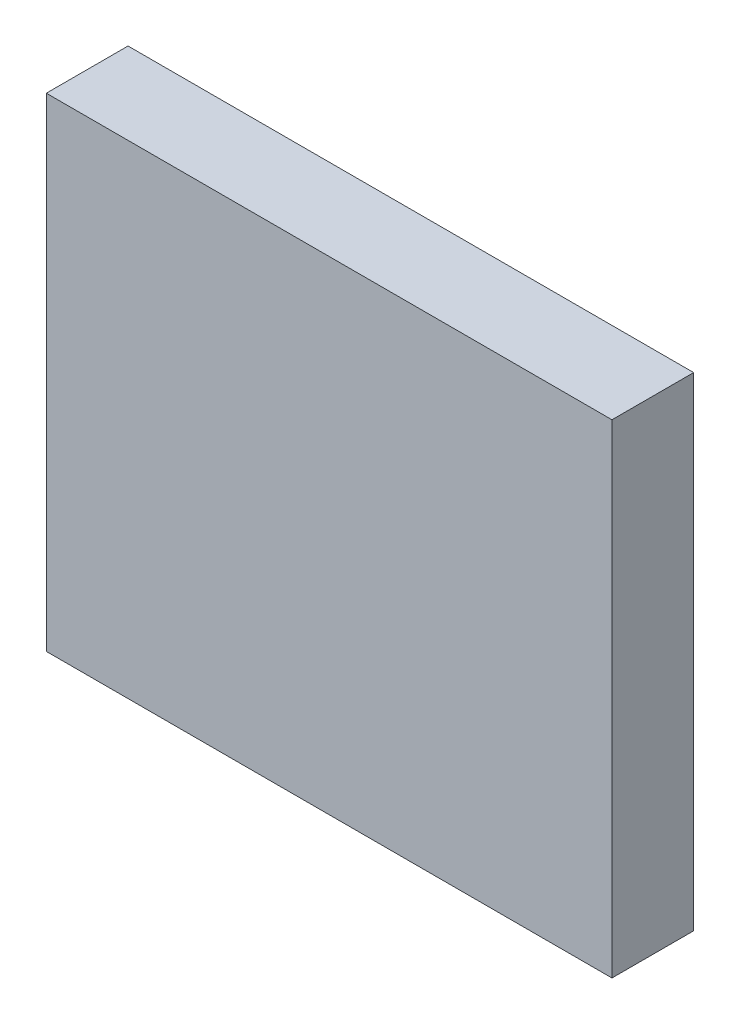
from build123d import *

# Parameters (mm, degrees)
SKETCH1_W               = 6.9215
SKETCH1_H               = 5.915659
COMPONENT_OUTLINE_DEPTH = 1


with BuildPart() as part:
    # Sketch1 → Component_Outline (new body)
    with BuildSketch(Plane.XY):
        with Locations((-0.15875, 0.2654295)):
            Rectangle(SKETCH1_W, SKETCH1_H)
    extrude(amount=COMPONENT_OUTLINE_DEPTH)


solid = part.part
